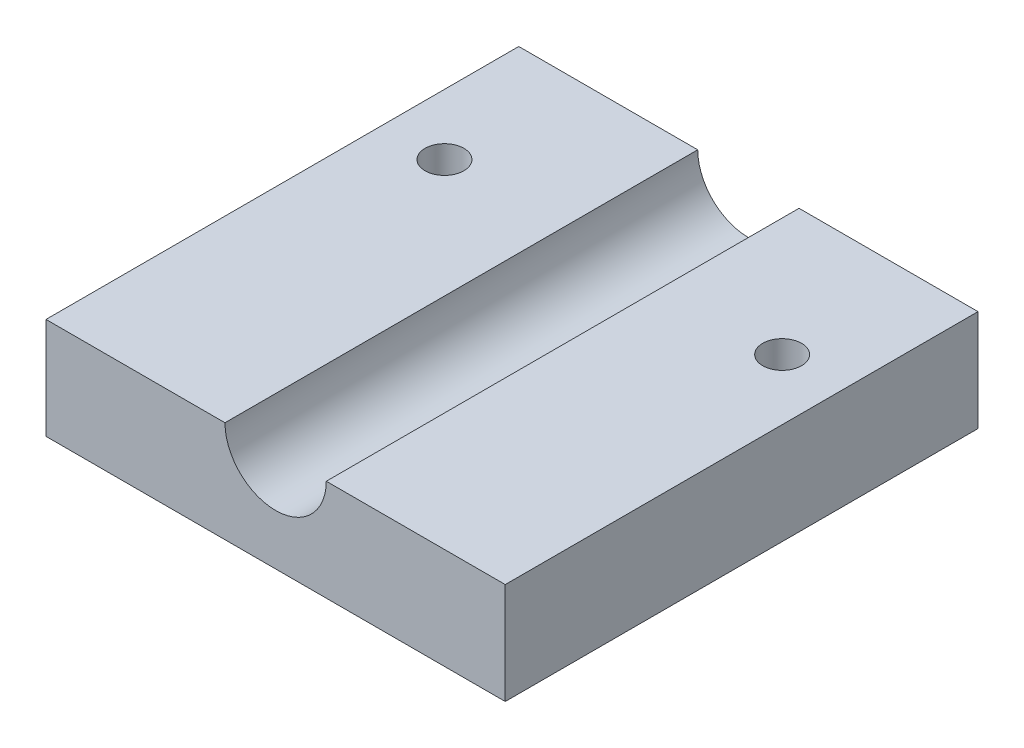
from build123d import *

# Parameters (mm, degrees)
SKETCH1_W                                      = 43.18
SKETCH1_H                                      = 44.45
BOSS_EXTRUDE1_DEPTH                            = 9.525
SKETCH4_R                                      = 4.7625
CUT_EXTRUDE1_DEPTH                             = 51.32550273
MOTORHOLES_D                                   = 2.2606
MOTORHOLES_DEPTH                               = 6.35
MOTORHOLES_TIP                                 = 0.679152758
CBORE_FOR_6_SOCKET_HEAD_CAP_SCREW1_D           = 3.6576
CBORE_FOR_6_SOCKET_HEAD_CAP_SCREW1_CBORE_D     = 7.14502
CBORE_FOR_6_SOCKET_HEAD_CAP_SCREW1_CBORE_DEPTH = 3.5052


with BuildPart() as part:
    # Sketch1 → Boss-Extrude1 (new body)
    with BuildSketch(Plane(origin=(0, 0, 0), x_dir=(1, 0, 0), z_dir=(0, 1, 0))):
        Rectangle(SKETCH1_W, SKETCH1_H)
    extrude(amount=BOSS_EXTRUDE1_DEPTH)

    # Sketch4 → Cut-Extrude1 (cut, through all)
    with BuildSketch(Plane.XY.offset(22.225)):
        with Locations((0, 9.525)):
            Circle(SKETCH4_R)
    extrude(amount=-CUT_EXTRUDE1_DEPTH, mode=Mode.SUBTRACT)

    # MotorHoles
    with Locations(Plane(origin=(0, 0, 0), x_dir=(-1, 0, 0), z_dir=(0, -1, 0))):
        with Locations((-5.715, -19.05), (5.715, -19.05), (13.081, 19.9644), (-13.081, 19.9644)):
            Hole(MOTORHOLES_D / 2, depth=MOTORHOLES_DEPTH)
            with Locations((0, 0, -(MOTORHOLES_DEPTH + MOTORHOLES_TIP / 2))):  # 118° drill point
                Cone(0, MOTORHOLES_D / 2, MOTORHOLES_TIP, mode=Mode.SUBTRACT)

    # CBORE for #6 Socket Head Cap Screw1 (through all)
    with Locations(Plane(origin=(0, 0, 0), x_dir=(-1, 0, 0), z_dir=(0, -1, 0))):
        with Locations((-15.875, 9.525), (15.875, 9.525)):
            CounterBoreHole(CBORE_FOR_6_SOCKET_HEAD_CAP_SCREW1_D / 2, CBORE_FOR_6_SOCKET_HEAD_CAP_SCREW1_CBORE_D / 2, CBORE_FOR_6_SOCKET_HEAD_CAP_SCREW1_CBORE_DEPTH)


solid = part.part
